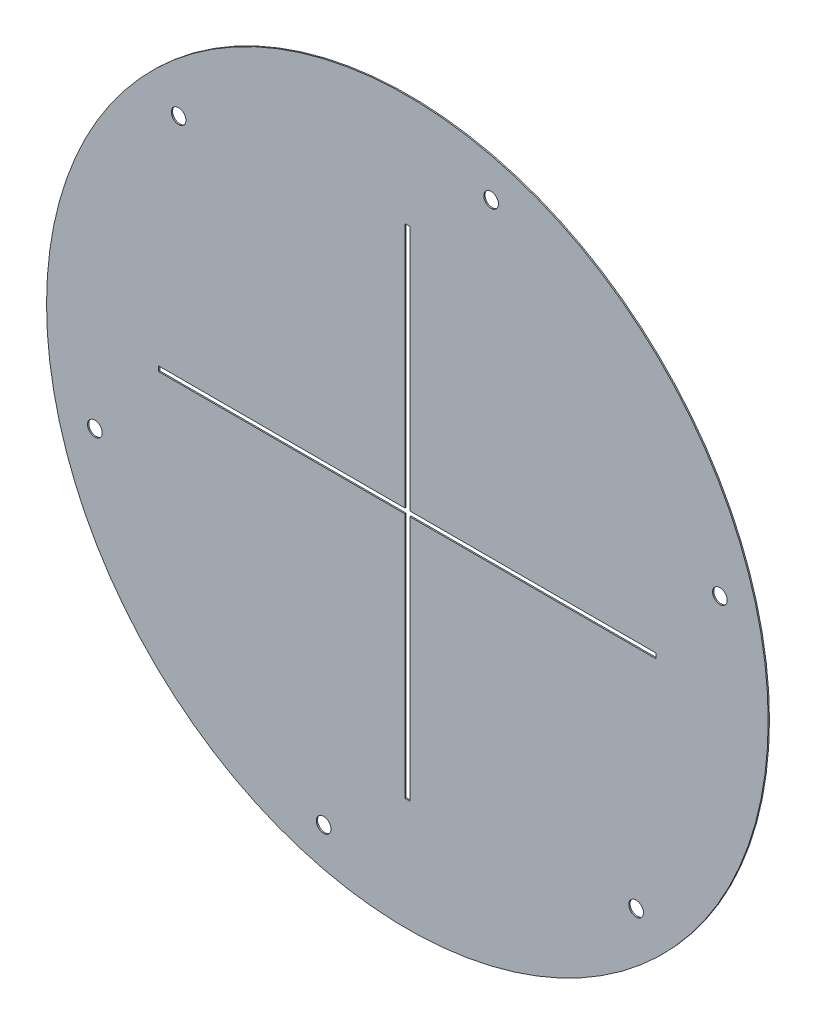
from build123d import *

# Parameters (mm, degrees)
SKETCH2_R           = 72.5
SKETCH2_R_2         = 1.4732
BOSS_EXTRUDE3_DEPTH = 0.254


with BuildPart() as part:
    # Sketch2 → Boss-Extrude3 (new body)
    with BuildSketch(Plane.XY):
        Circle(SKETCH2_R)
        with Locations((62.785178709, 16.823237932)):
            Circle(SKETCH2_R_2, mode=Mode.SUBTRACT)
        with Locations((-62.785178709, -16.823237932)):
            Circle(SKETCH2_R_2, mode=Mode.SUBTRACT)
        with Locations((16.823237932, 62.785178709)):
            Circle(SKETCH2_R_2, mode=Mode.SUBTRACT)
        with Locations((-16.823237932, -62.785178709)):
            Circle(SKETCH2_R_2, mode=Mode.SUBTRACT)
        with Locations((45.961940777, -45.961940777)):
            Circle(SKETCH2_R_2, mode=Mode.SUBTRACT)
        with Locations((-45.961940777, 45.961940777)):
            Circle(SKETCH2_R_2, mode=Mode.SUBTRACT)
        Polygon((-0.5, 50), (-0.5, 0.5), (-50, 0.5), (-50, -0.5), (-0.5, -0.5), (-0.5, -50), (0.5, -50), (0.5, -0.5), (50, -0.5), (50, 0.5), (0.5, 0.5), (0.5, 50), align=None, mode=Mode.SUBTRACT)
    extrude(amount=BOSS_EXTRUDE3_DEPTH)


solid = part.part
